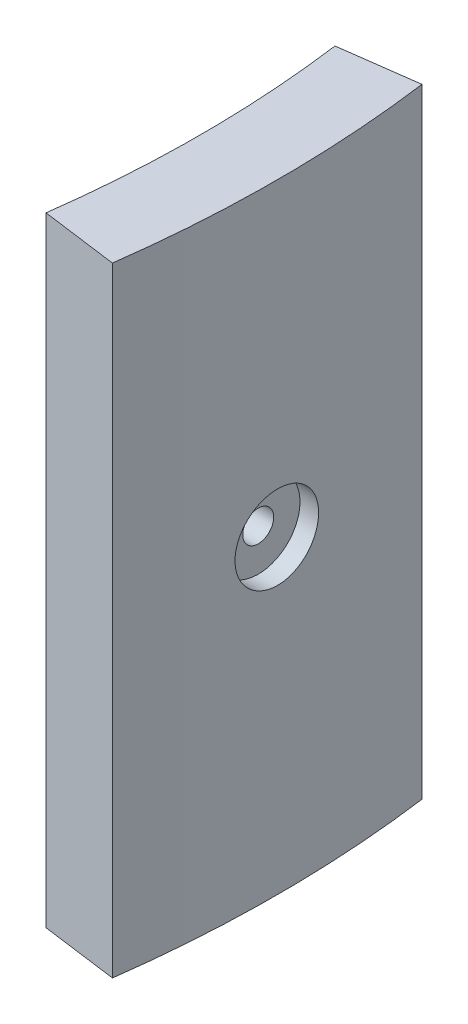
from build123d import *

# Parameters (mm, degrees)
BOSS_EXTRUDE1_DEPTH = 25.4
SKETCH5_R           = 3.429
CUT_EXTRUDE1_DEPTH  = 1.5875
SKETCH6_R           = 1.27
CUT_EXTRUDE2_DEPTH  = 29.93651842


with BuildPart() as part:
    # Sketch4 → Boss-Extrude1 (new, symmetric)
    with BuildSketch(Plane(origin=(0, 0, 0), x_dir=(1, 0, 0), z_dir=(0, 1, 0))):
        with BuildLine():
            Line((94.399536545, 12.7), (88.106234109, 11.853333333))
            ThreePointArc((88.106234109, 11.853333333), (88.9, 0), (88.106234109, -11.853333333))
            Line((88.106234109, -11.853333333), (94.399536545, -12.7))
            ThreePointArc((94.399536545, -12.7), (95.25, 0), (94.399536545, 12.7))
        make_face()
    extrude(amount=BOSS_EXTRUDE1_DEPTH, both=True)

    # Sketch5 → Cut-Extrude1 (cut)
    with BuildSketch(Plane(origin=(95.25, 25.4, 0), x_dir=(0, 0, -1), z_dir=(1, 0, 0))):
        with Locations((0, -25.4)):
            Circle(SKETCH5_R)
    extrude(amount=-CUT_EXTRUDE1_DEPTH, mode=Mode.SUBTRACT)

    # Sketch6 → Cut-Extrude2 (cut, through all)
    with BuildSketch(Plane(origin=(93.6625, 0, 0), x_dir=(0, 0, -1), z_dir=(1, 0, 0))):
        Circle(SKETCH6_R)
    extrude(amount=-CUT_EXTRUDE2_DEPTH, mode=Mode.SUBTRACT)


solid = part.part
